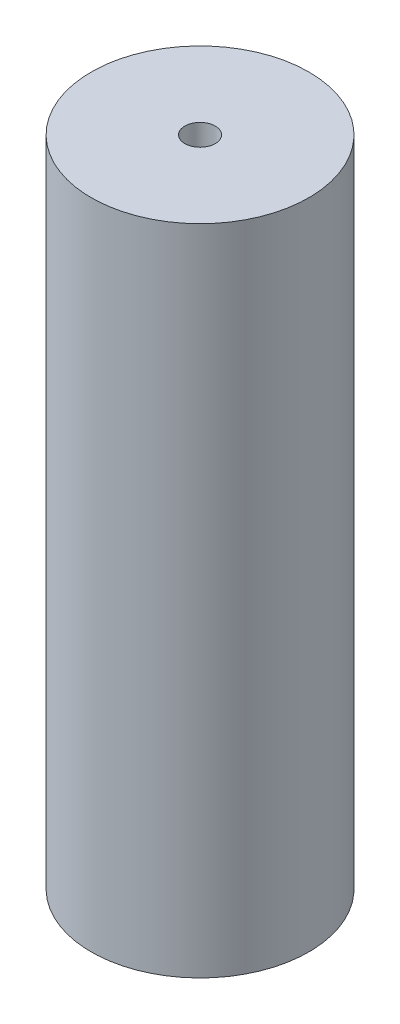
from build123d import *


with BuildPart() as part:
    # Sketch1 → Revolve1 (revolve)
    with BuildSketch(Plane.XY, mode=Mode.PRIVATE) as revolve1_sk:
        Polygon((-0.35, 15), (-0.35, 5), (-1.25, 5), (-1.25, 0), (-2.5, 0), (-2.5, 15), align=None)
    revolve(revolve1_sk.sketch.rotate(Axis((0, 0, 0), (0, 1, 0)), 270), axis=Axis((0, 0, 0), (0, 1, 0)))


solid = part.part
